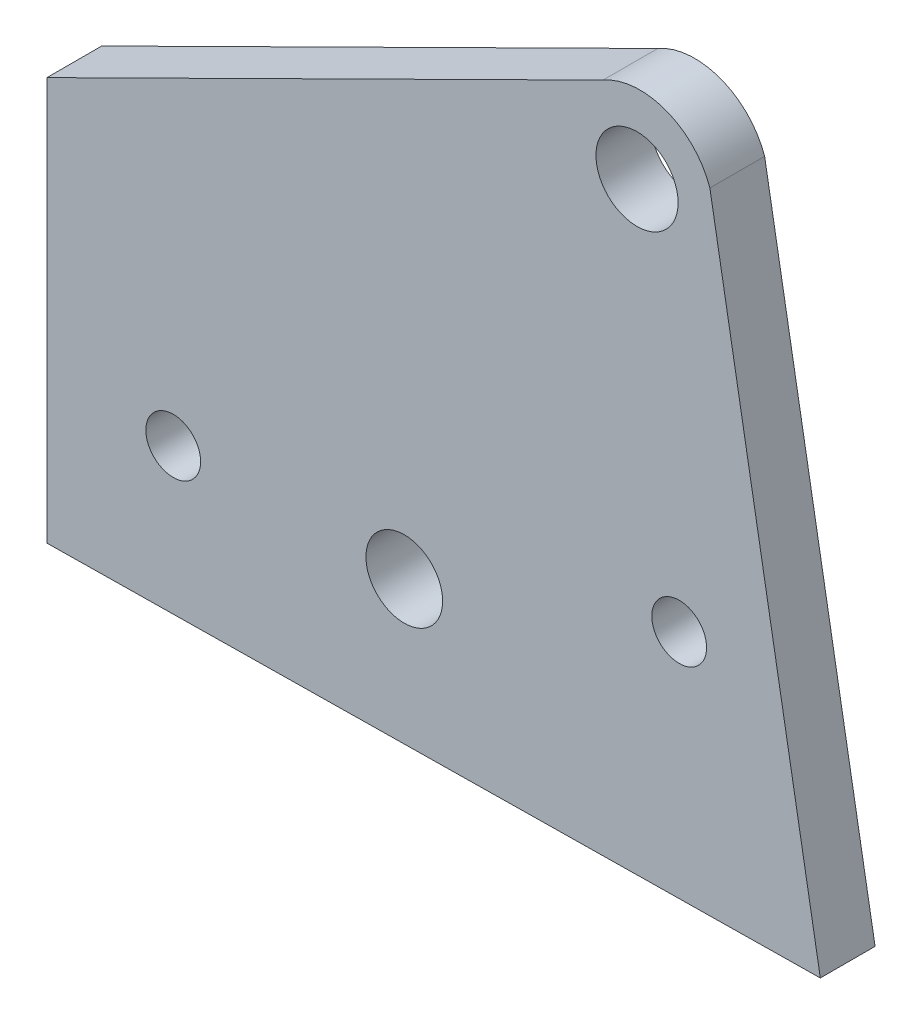
from build123d import *

# Parameters (mm, degrees)
SKETCH1_R           = 2.1
SKETCH1_R_2         = 2.25
SKETCH1_R_3         = 1.5
BOSS_EXTRUDE2_DEPTH = 3


with BuildPart() as part:
    # Sketch1 → Boss-Extrude2 (new body)
    with BuildSketch(Plane.XY):
        with BuildLine():
            Line((-27.248541099, 19.686096161), (-57.707535143, 4.573632695))
            Line((-57.707535143, 4.573632695), (-57.707535143, -17.510368624))
            Line((-57.707535143, -17.510368624), (-15.340272848, -16.957179715))
            Line((-15.340272848, -16.957179715), (-21.390839368, 17.496417988))
            ThreePointArc((-21.390839368, 17.496417988), (-23.801885744, 19.97645801), (-27.248541099, 19.686096161))
        make_face()
        with Locations((-38.131817883, -9.421553771)):
            Circle(SKETCH1_R, mode=Mode.SUBTRACT)
        with Locations((-25.381817883, 15.923737268)):
            Circle(SKETCH1_R_2, mode=Mode.SUBTRACT)
        with Locations((-23.071502026, -4.400056763)):
            Circle(SKETCH1_R_3, mode=Mode.SUBTRACT)
        with Locations((-50.787681668, -9.435461189)):
            Circle(SKETCH1_R_3, mode=Mode.SUBTRACT)
    extrude(amount=BOSS_EXTRUDE2_DEPTH)


solid = part.part
